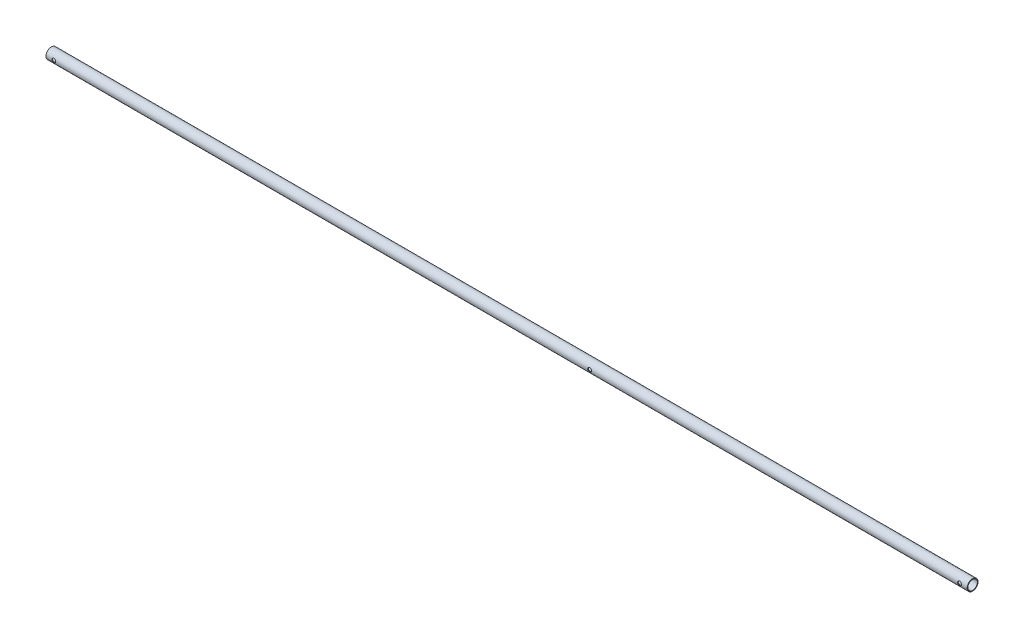
from build123d import *

# Parameters (mm, degrees)
SKETCH1_R               = 8.9662
SKETCH1_R_2             = 7.8994
BOSS_EXTRUDE1_DEPTH     = 1524
CUT_EXTRUDE1_DEPTH      = 1525.05275023
CUT_EXTRUDE1_DEPTH_BACK = 1525.05275023
SKETCH2_R               = 3.175


with BuildPart() as part:
    # Sketch1 → Boss-Extrude1 (new body)
    with BuildSketch(Plane(origin=(0, 0, 0), x_dir=(0, 0, -1), z_dir=(1, 0, 0))):
        Circle(SKETCH1_R)
        Circle(SKETCH1_R_2, mode=Mode.SUBTRACT)
    extrude(amount=BOSS_EXTRUDE1_DEPTH)

    # Sketch2 → Cut-Extrude1 (cut, two sides: drawn at the far end of the back side and taken through both)
    with BuildSketch(Plane.XY.offset(-CUT_EXTRUDE1_DEPTH_BACK)):
        with Locations((1511.3, 0)):
            Circle(SKETCH2_R)
        with Locations((12.7, 0)):
            Circle(SKETCH2_R)
        with Locations((899.3378, 0)):
            Circle(SKETCH2_R)
    extrude(amount=CUT_EXTRUDE1_DEPTH + CUT_EXTRUDE1_DEPTH_BACK, mode=Mode.SUBTRACT)


solid = part.part
